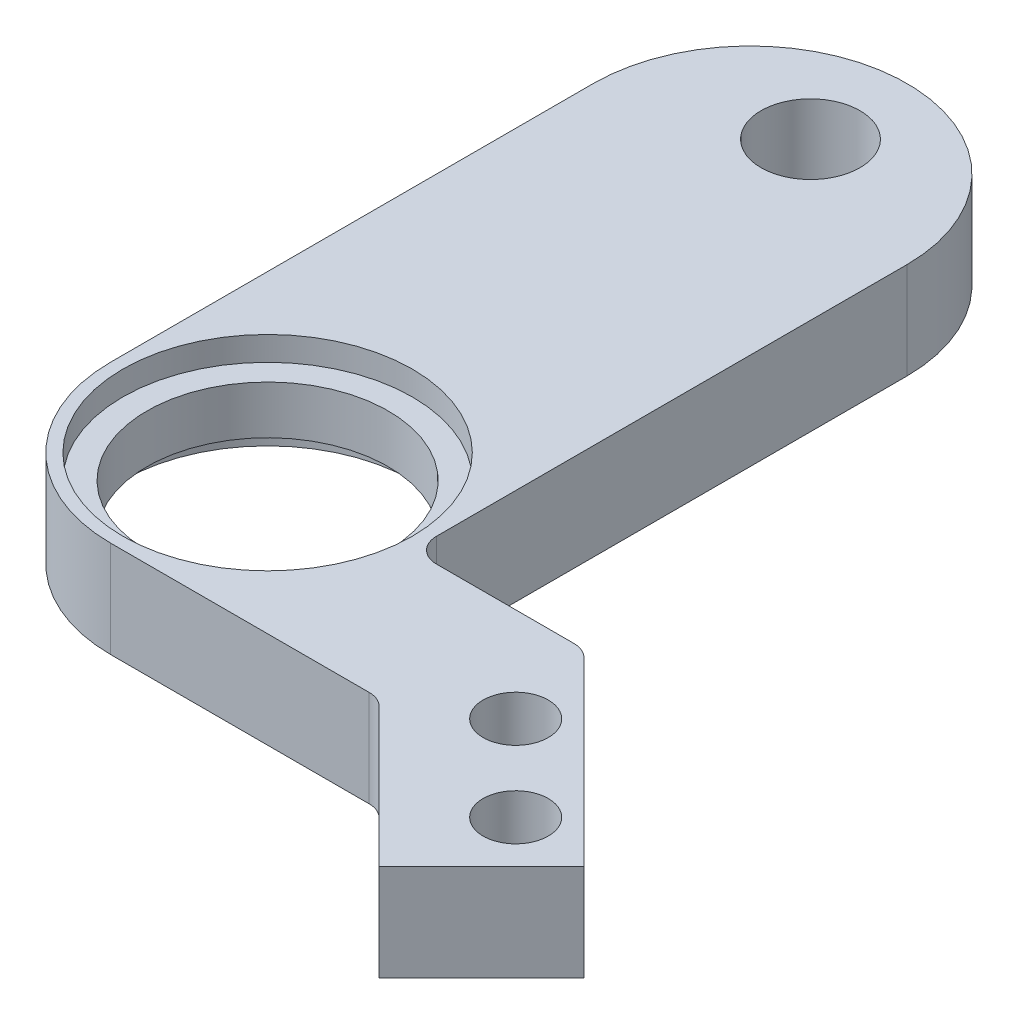
from build123d import *

# Parameters (mm, degrees)
BOSS_EXTRUDE1_DEPTH        = 4
DRAFT1_ANGLE               = 45.000000004
DRAFT2_ANGLE               = 45.000000005
F_4_1_4_1_DIAMETER_HOLE1_D = 4.1
F_2_7_2_7_DIAMETER_HOLE1_D = 2.7
FILLET1_R                  = 1
FILLET2_R                  = 6.5


with BuildPart() as part:
    # Sketch1 → Boss-Extrude1 (new body)
    with BuildSketch(Plane.XZ.offset(2)):
        with BuildLine():
            Line((11.124319466, 26.5), (-6.5, 26.5))
            Line((-6.5, 26.5), (-6.5, 0))
            ThreePointArc((-6.5, 0), (3e-09, -6.500000003), (6.500000005, 0))
            Line((6.500000005, 0), (6.500000005, 20.5))
            Line((6.500000005, 20.5), (13.60960084, 20.5))
            Line((13.60960084, 20.5), (13.60960084, 36.100603473))
            Line((13.60960084, 36.100603473), (11.124319466, 38.585884847))
            Line((11.124319466, 38.585884847), (11.124319466, 26.5))
        make_face()
    extrude(amount=-BOSS_EXTRUDE1_DEPTH)

    # Draft1
    draft1_faces = [part.faces().sort_by_distance(p)[0] for p in [
        (13.60960084, 0, 28.300301737),
    ]]
    draft(draft1_faces, Plane(origin=(6.500000005, 2, 20.5), x_dir=(-1, 0, 0), z_dir=(0, 0, -1)), DRAFT1_ANGLE)

    # Draft2
    draft2_faces = [part.faces().sort_by_distance(p)[0] for p in [
        (11.124319466, 0, 32.542942424),
    ]]
    draft(draft2_faces, Plane(origin=(11.124319466, 2, 26.5), x_dir=(1, 0, 0), z_dir=(0, 0, 1)), DRAFT2_ANGLE)

    # Sketch2 → Cut-Revolve1 (revolve, cut)
    with BuildSketch(Plane.XY.offset(20)):
        Polygon((6, 2), (0, 2), (0, -2), (6, -2), (6, -1), (5, -1), (5, 1), (6, 1), align=None)
    revolve(axis=Axis((0, 2, 20), (0, -1, 0)), mode=Mode.SUBTRACT)

    # Ø4.1 (4.1) Diameter Hole1 (through all)
    with Locations(Plane(origin=(0, 2, 0), x_dir=(1, 0, 0), z_dir=(0, 1, 0))):
        with Locations((0, 2.5)):
            Hole(F_4_1_4_1_DIAMETER_HOLE1_D / 2)

    # Ø2.7 (2.7) Diameter Hole1 (through all)
    with Locations(Plane(origin=(0, -2, 0), x_dir=(-1, 0, 0), z_dir=(0, -1, 0))):
        with Locations((-14.692388155, -24.41121444), (-18.227922061, -27.946748346)):
            Hole(F_2_7_2_7_DIAMETER_HOLE1_D / 2)

    # Fillet1
    fillet1_edges = [part.edges().sort_by_distance(p)[0] for p in [
        (13.60960084, 0, 20.5),
        (6.500000005, 0, 20.5),
        (11.124319466, 0, 26.5),
    ]]
    fillet(fillet1_edges, radius=FILLET1_R)

    # Fillet2
    fillet2_edges = [part.edges().sort_by_distance(p)[0] for p in [
        (-6.5, 0, 26.5),
    ]]
    fillet(fillet2_edges, radius=FILLET2_R)


solid = part.part
